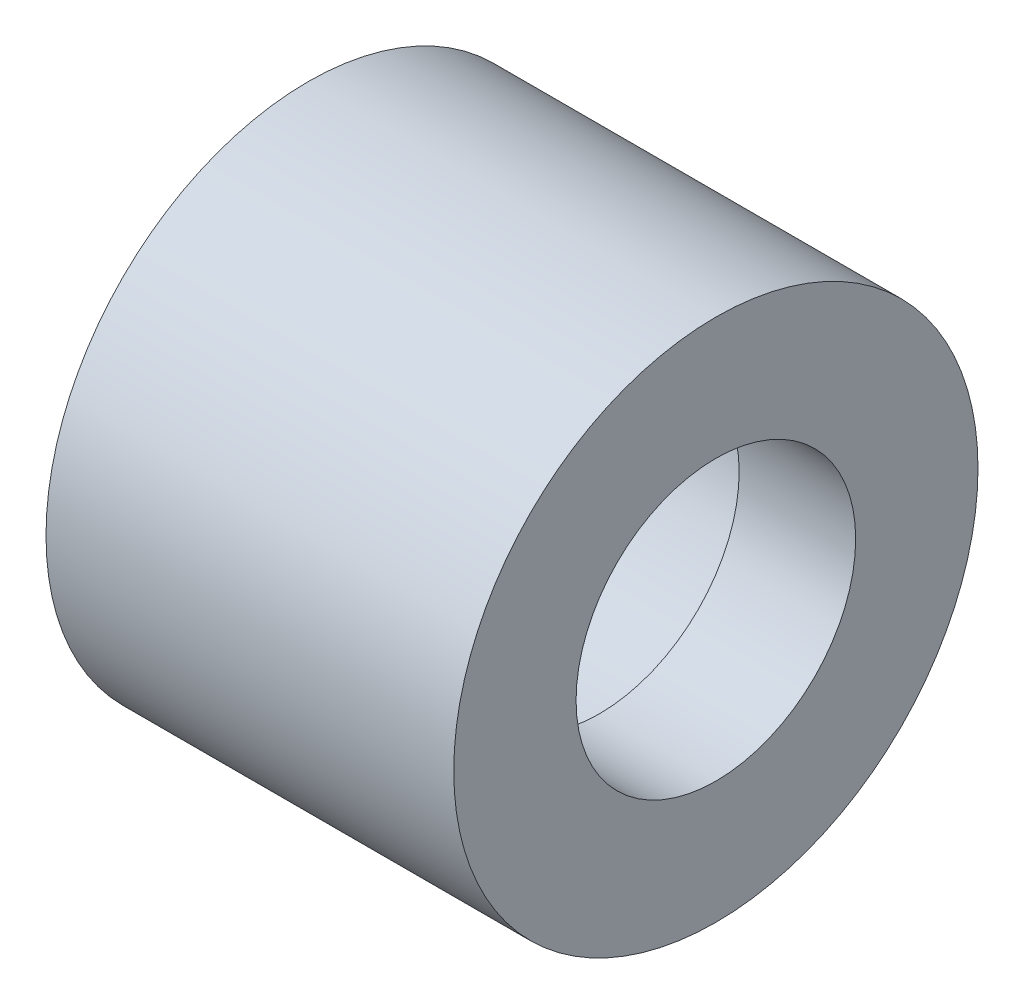
from build123d import *


with BuildPart() as part:
    # Axial profile (mm) → Full revolution (revolve)
    with BuildSketch(Plane.XY, mode=Mode.PRIVATE) as full_revolution_sk:
        Polygon((66, 3.175), (71, 3.175), (71, 2.4), (73, 2.4), (73, 4.5), (66, 4.5), align=None)
    revolve(full_revolution_sk.sketch.rotate(Axis((-110, 0, 0), (1, 0, 0)), 90), axis=Axis((-110, 0, 0), (1, 0, 0)))


solid = part.part
